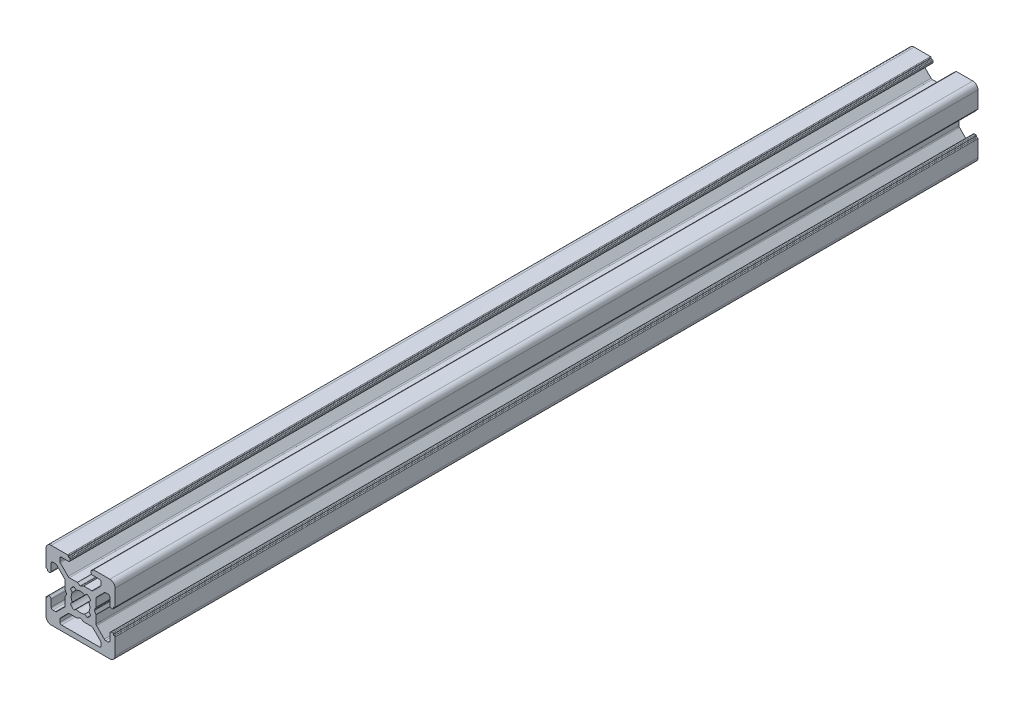
from build123d import *

# Parameters (mm, degrees)
EXTRUDE1_DEPTH = 250


with BuildPart() as part:
    # Sketch1 → Extrude1 (new body)
    with BuildSketch(Plane.XY):
        with BuildLine():
            Line((3, 8.999999384), (3, 9.299999384))
            ThreePointArc((3, 9.299999384), (3.058578644, 9.44142074), (3.2, 9.499999384))
            Line((3.2, 9.499999384), (3.350000624, 9.499999384))
            ThreePointArc((3.350000624, 9.499999384), (3.49142198, 9.558578027), (3.550000624, 9.699999384))
            Line((3.550000624, 9.699999384), (3.550000624, 9.8))
            ThreePointArc((3.550000624, 9.8), (3.608579267, 9.941421356), (3.750000624, 10))
            Line((3.750000624, 10), (8.500000624, 10))
            ThreePointArc((8.500000624, 10), (9.560660354, 9.560660354), (10, 8.500000624))
            Line((10, 8.500000624), (10, 3.749999518))
            ThreePointArc((10, 3.749999518), (9.94142198, 3.608578161), (9.800000624, 3.549999518))
            Line((9.800000624, 3.549999518), (9.700000525, 3.549999518))
            ThreePointArc((9.700000525, 3.549999518), (9.558579169, 3.491420874), (9.500000525, 3.349999518))
            Line((9.500000525, 3.349999518), (9.500000525, 3.149999555))
            ThreePointArc((9.500000525, 3.149999555), (9.441421882, 3.008578198), (9.300000525, 2.949999555))
            Line((9.300000525, 2.949999555), (9.000000525, 2.949999555))
            ThreePointArc((9.000000525, 2.949999555), (8.646447135, 3.096446164), (8.500000525, 3.449999555))
            Line((8.500000525, 3.449999555), (8.500000525, 5.499999518))
            ThreePointArc((8.500000525, 5.499999518), (8.353553916, 5.853552908), (8.000000525, 5.999999518))
            Line((8.000000525, 5.999999518), (7.267767491, 5.999999518))
            ThreePointArc((7.267767491, 5.999999518), (7.076425769, 5.961939282), (6.914214091, 5.8535529))
            Line((6.914214091, 5.8535529), (4.64644725, 3.585785948))
            ThreePointArc((4.64644725, 3.585785948), (4.538060881, 3.423574277), (4.50000065, 3.232232566))
            Line((4.50000065, 3.232232566), (4.50000065, 0.953589551))
            ThreePointArc((4.50000065, 0.953589551), (4.493185815, 0.901825742), (4.47320573, 0.853589551))
            Line((4.47320573, 0.853589551), (4.038120198, 0.099999304))
            ThreePointArc((4.038120198, 0.099999304), (4.011325279, -6.96e-07), (4.038120198, -0.100000696))
            Line((4.038120198, -0.100000696), (4.473205494, -0.853590535))
            ThreePointArc((4.473205494, -0.853590535), (4.493185579, -0.901826725), (4.500000414, -0.953590535))
            Line((4.500000414, -0.953590535), (4.500000414, -3.232233897))
            ThreePointArc((4.500000414, -3.232233897), (4.538060643, -3.423575602), (4.646447006, -3.585787271))
            Line((4.646447006, -3.585787271), (6.914213791, -5.853554277))
            ThreePointArc((6.914213791, -5.853554277), (7.076425472, -5.961940665), (7.267767199, -6.000000904))
            Line((7.267767199, -6.000000904), (8.000000414, -6.000000904))
            ThreePointArc((8.000000414, -6.000000904), (8.353553804, -5.853554294), (8.500000414, -5.500000904))
            Line((8.500000414, -5.500000904), (8.500000414, -3.550000445))
            ThreePointArc((8.500000414, -3.550000445), (8.646447023, -3.196447055), (9.000000414, -3.050000445))
            Line((9.000000414, -3.050000445), (9.300000414, -3.050000445))
            ThreePointArc((9.300000414, -3.050000445), (9.44142177, -3.108579089), (9.500000414, -3.250000445))
            Line((9.500000414, -3.250000445), (9.500000414, -3.350000445))
            ThreePointArc((9.500000414, -3.350000445), (9.558579057, -3.491421802), (9.700000414, -3.550000445))
            Line((9.700000414, -3.550000445), (9.800000414, -3.550000445))
            ThreePointArc((9.800000414, -3.550000445), (9.94142177, -3.608579089), (10.000000414, -3.750000445))
            Line((10.000000414, -3.750000445), (10.000000414, -8.5))
            ThreePointArc((10.000000414, -8.5), (9.560660585, -9.560660172), (8.500000414, -10))
            Line((8.500000414, -10), (-8.500000414, -10))
            ThreePointArc((-8.500000414, -10), (-9.560660585, -9.560660172), (-10.000000414, -8.5))
            Line((-10.000000414, -8.5), (-10.000000414, -3.750000445))
            ThreePointArc((-10.000000414, -3.750000445), (-9.94142177, -3.608579089), (-9.800000414, -3.550000445))
            Line((-9.800000414, -3.550000445), (-9.700000414, -3.550000445))
            ThreePointArc((-9.700000414, -3.550000445), (-9.558579057, -3.491421802), (-9.500000414, -3.350000445))
            Line((-9.500000414, -3.350000445), (-9.500000414, -3.250000445))
            ThreePointArc((-9.500000414, -3.250000445), (-9.44142177, -3.108579089), (-9.300000414, -3.050000445))
            Line((-9.300000414, -3.050000445), (-9.000000414, -3.050000445))
            ThreePointArc((-9.000000414, -3.050000445), (-8.646447023, -3.196447055), (-8.500000414, -3.550000445))
            Line((-8.500000414, -3.550000445), (-8.500000414, -5.500000904))
            ThreePointArc((-8.500000414, -5.500000904), (-8.353553804, -5.853554294), (-8.000000414, -6.000000904))
            Line((-8.000000414, -6.000000904), (-7.267767199, -6.000000904))
            ThreePointArc((-7.267767199, -6.000000904), (-7.076425472, -5.961940665), (-6.914213791, -5.853554277))
            Line((-6.914213791, -5.853554277), (-4.646447006, -3.585787271))
            ThreePointArc((-4.646447006, -3.585787271), (-4.538060643, -3.423575602), (-4.500000414, -3.232233897))
            Line((-4.500000414, -3.232233897), (-4.500000414, -0.953590535))
            ThreePointArc((-4.500000414, -0.953590535), (-4.493185579, -0.901826725), (-4.473205494, -0.853590535))
            Line((-4.473205494, -0.853590535), (-4.038120198, -0.100000696))
            ThreePointArc((-4.038120198, -0.100000696), (-4.011325279, -6.96e-07), (-4.038120198, 0.099999304))
            Line((-4.038120198, 0.099999304), (-4.47320573, 0.853589551))
            ThreePointArc((-4.47320573, 0.853589551), (-4.493185815, 0.901825742), (-4.50000065, 0.953589551))
            Line((-4.50000065, 0.953589551), (-4.50000065, 3.232232566))
            ThreePointArc((-4.50000065, 3.232232566), (-4.538060881, 3.423574277), (-4.64644725, 3.585785948))
            Line((-4.64644725, 3.585785948), (-6.914214091, 5.8535529))
            ThreePointArc((-6.914214091, 5.8535529), (-7.076425769, 5.961939282), (-7.267767491, 5.999999518))
            Line((-7.267767491, 5.999999518), (-8.000000525, 5.999999518))
            ThreePointArc((-8.000000525, 5.999999518), (-8.353553916, 5.853552908), (-8.500000525, 5.499999518))
            Line((-8.500000525, 5.499999518), (-8.500000525, 3.449999555))
            ThreePointArc((-8.500000525, 3.449999555), (-8.646447135, 3.096446164), (-9.000000525, 2.949999555))
            Line((-9.000000525, 2.949999555), (-9.300000525, 2.949999555))
            ThreePointArc((-9.300000525, 2.949999555), (-9.441421882, 3.008578198), (-9.500000525, 3.149999555))
            Line((-9.500000525, 3.149999555), (-9.500000525, 3.349999518))
            ThreePointArc((-9.500000525, 3.349999518), (-9.558579169, 3.491420874), (-9.700000525, 3.549999518))
            Line((-9.700000525, 3.549999518), (-9.800000624, 3.549999518))
            ThreePointArc((-9.800000624, 3.549999518), (-9.94142198, 3.608578161), (-10, 3.749999518))
            Line((-10, 3.749999518), (-10, 8.500000624))
            ThreePointArc((-10, 8.500000624), (-9.560660354, 9.560660354), (-8.500000624, 10))
            Line((-8.500000624, 10), (-3.750000624, 10))
            ThreePointArc((-3.750000624, 10), (-3.608579267, 9.941421356), (-3.550000624, 9.8))
            Line((-3.550000624, 9.8), (-3.550000624, 9.699999384))
            ThreePointArc((-3.550000624, 9.699999384), (-3.49142198, 9.558578027), (-3.350000624, 9.499999384))
            Line((-3.350000624, 9.499999384), (-3.2, 9.499999384))
            ThreePointArc((-3.2, 9.499999384), (-3.058578644, 9.44142074), (-3, 9.299999384))
            Line((-3, 9.299999384), (-3, 8.999999384))
            ThreePointArc((-3, 8.999999384), (-3.146446609, 8.646445993), (-3.5, 8.499999384))
            Line((-3.5, 8.499999384), (-5.500001082, 8.499999384))
            ThreePointArc((-5.500001082, 8.499999384), (-5.853554473, 8.353552774), (-6.000001082, 7.999999384))
            Line((-6.000001082, 7.999999384), (-6.000001082, 7.267766268))
            ThreePointArc((-6.000001082, 7.267766268), (-5.961940846, 7.076424546), (-5.853554464, 6.914212869))
            Line((-5.853554464, 6.914212869), (-3.585787513, 4.646446028))
            ThreePointArc((-3.585787513, 4.646446028), (-3.423575841, 4.538059658), (-3.232234131, 4.499999427))
            Line((-3.232234131, 4.499999427), (-0.953590803, 4.499999427))
            ThreePointArc((-0.953590803, 4.499999427), (-0.901826983, 4.493184589), (-0.853590783, 4.473204496))
            Line((-0.853590783, 4.473204496), (-0.100000994, 4.038119115))
            ThreePointArc((-0.100000994, 4.038119115), (0, 4.011323697), (0.100000994, 4.038119115))
            Line((0.100000994, 4.038119115), (0.853590783, 4.473204496))
            ThreePointArc((0.853590783, 4.473204496), (0.901826983, 4.493184589), (0.953590803, 4.499999427))
            Line((0.953590803, 4.499999427), (3.232234131, 4.499999427))
            ThreePointArc((3.232234131, 4.499999427), (3.423575841, 4.538059658), (3.585787513, 4.646446028))
            Line((3.585787513, 4.646446028), (5.853554464, 6.914212869))
            ThreePointArc((5.853554464, 6.914212869), (5.961940846, 7.076424546), (6.000001082, 7.267766268))
            Line((6.000001082, 7.267766268), (6.000001082, 7.999999384))
            ThreePointArc((6.000001082, 7.999999384), (5.853554473, 8.353552774), (5.500001082, 8.499999384))
            Line((5.500001082, 8.499999384), (3.5, 8.499999384))
            ThreePointArc((3.5, 8.499999384), (3.146446609, 8.646445993), (3, 8.999999384))
        make_face()
        with BuildLine():
            Line((-5.500000242, -8.499999877), (5.500000242, -8.499999877))
            ThreePointArc((5.500000242, -8.499999877), (5.853553633, -8.353553268), (6.000000242, -7.999999877))
            Line((6.000000242, -7.999999877), (6.000000242, -7.267766878))
            ThreePointArc((6.000000242, -7.267766878), (5.961940006, -7.076425156), (5.853553624, -6.914213479))
            Line((5.853553624, -6.914213479), (3.585786637, -4.646446602))
            ThreePointArc((3.585786637, -4.646446602), (3.423574966, -4.538060233), (3.232233255, -4.500000001))
            Line((3.232233255, -4.500000001), (0.953589836, -4.500000001))
            ThreePointArc((0.953589836, -4.500000001), (0.901826025, -4.493185166), (0.853589832, -4.47320508))
            Line((0.853589832, -4.47320508), (0.100000004, -4.038119765))
            ThreePointArc((0.100000004, -4.038119765), (0, -4.011324843), (-0.100000004, -4.038119765))
            Line((-0.100000004, -4.038119765), (-0.853589832, -4.47320508))
            ThreePointArc((-0.853589832, -4.47320508), (-0.901826025, -4.493185166), (-0.953589836, -4.500000001))
            Line((-0.953589836, -4.500000001), (-3.232233255, -4.500000001))
            ThreePointArc((-3.232233255, -4.500000001), (-3.423574966, -4.538060233), (-3.585786637, -4.646446602))
            Line((-3.585786637, -4.646446602), (-5.853553624, -6.914213479))
            ThreePointArc((-5.853553624, -6.914213479), (-5.961940006, -7.076425156), (-6.000000242, -7.267766878))
            Line((-6.000000242, -7.267766878), (-6.000000242, -7.999999877))
            ThreePointArc((-6.000000242, -7.999999877), (-5.853553633, -8.353553268), (-5.500000242, -8.499999877))
        make_face(mode=Mode.SUBTRACT)
        with BuildLine():
            Line((-1.235309337, 2.400835446), (-1.887055008, 2.947714945))
            ThreePointArc((-1.887055008, 2.947714945), (-2.474873794, 2.474873674), (-2.947715037, 1.887054865))
            Line((-2.947715037, 1.887054865), (-2.400835507, 1.23530922))
            ThreePointArc((-2.400835507, 1.23530922), (-2.7, -6.6e-08), (-2.400835446, -1.235309337))
            Line((-2.400835446, -1.235309337), (-2.947714945, -1.887055008))
            ThreePointArc((-2.947714945, -1.887055008), (-2.474873674, -2.474873794), (-1.887054865, -2.947715037))
            Line((-1.887054865, -2.947715037), (-1.23530922, -2.400835507))
            ThreePointArc((-1.23530922, -2.400835507), (0, -2.7), (1.23530922, -2.400835507))
            Line((1.23530922, -2.400835507), (1.887054865, -2.947715037))
            ThreePointArc((1.887054865, -2.947715037), (2.474873674, -2.474873794), (2.947714945, -1.887055008))
            Line((2.947714945, -1.887055008), (2.400835446, -1.235309337))
            ThreePointArc((2.400835446, -1.235309337), (2.7, -6.6e-08), (2.400835507, 1.23530922))
            Line((2.400835507, 1.23530922), (2.947715037, 1.887054865))
            ThreePointArc((2.947715037, 1.887054865), (2.474873794, 2.474873674), (1.887055008, 2.947714945))
            Line((1.887055008, 2.947714945), (1.235309337, 2.400835446))
            ThreePointArc((1.235309337, 2.400835446), (0, 2.7), (-1.235309337, 2.400835446))
        make_face(mode=Mode.SUBTRACT)
    extrude(amount=EXTRUDE1_DEPTH)


solid = part.part
